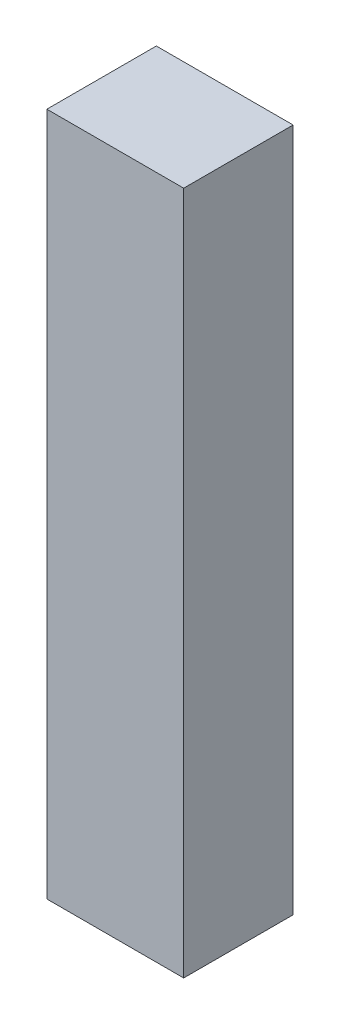
from build123d import *

# Parameters (mm, degrees)
SKETCH2_W           = 10
SKETCH2_H           = 8
BOSS_EXTRUDE1_DEPTH = 25


with BuildPart() as part:
    # Sketch2 → Boss-Extrude1 (new, symmetric)
    with BuildSketch(Plane(origin=(0, 0, 0), x_dir=(-1, 0, 0), z_dir=(0, 1, 0))):
        Rectangle(SKETCH2_W, SKETCH2_H)
    extrude(amount=BOSS_EXTRUDE1_DEPTH, both=True)


solid = part.part
